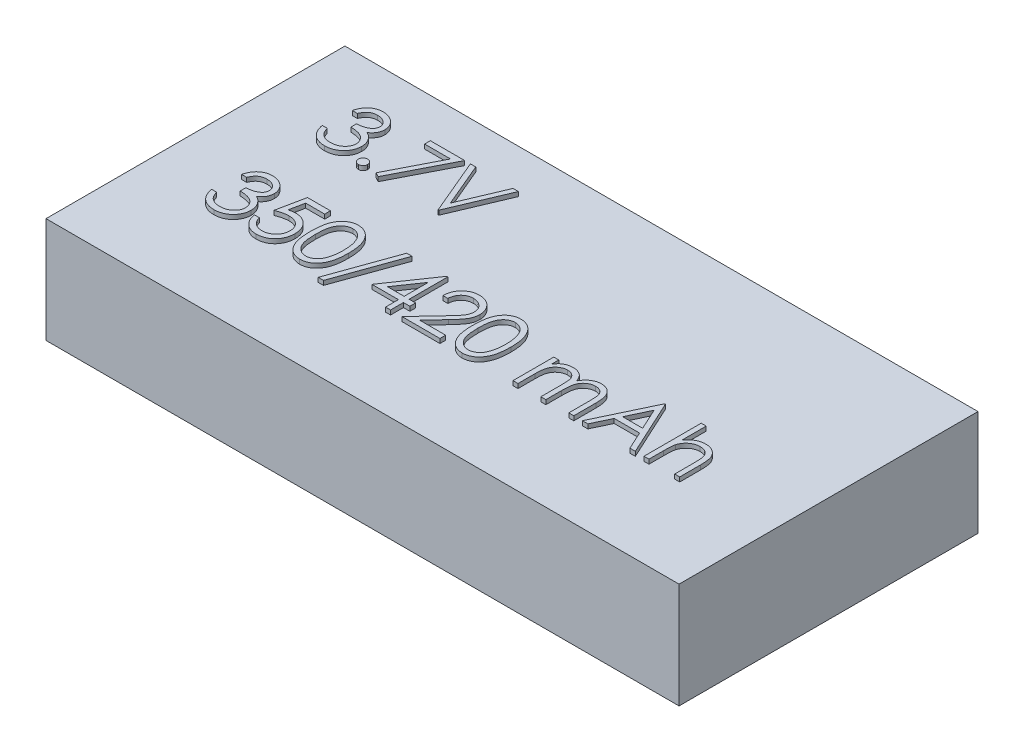
from build123d import *

# Parameters (mm, degrees)
SKETCH1_W           = 36
SKETCH1_H           = 17
BOSS_EXTRUDE1_DEPTH = 6
BOSS_EXTRUDE2_DEPTH = 0.25


with BuildPart() as part:
    # Sketch1 → Boss-Extrude1 (new body)
    with BuildSketch(Plane(origin=(0, 0, 0), x_dir=(1, 0, 0), z_dir=(0, 1, 0))):
        Rectangle(SKETCH1_W, SKETCH1_H)
    extrude(amount=BOSS_EXTRUDE1_DEPTH)

    # Sketch2 → Boss-Extrude2 (add)
    # profile 1 of 14: a face of its own
    with BuildSketch(Plane(origin=(0, 6, 0), x_dir=(1, 0, 0), z_dir=(0, 1, 0))):
        with BuildLine():
            Line((-14.07975886, 5.282911581), (-14.364694757, 5.282911581))
            add(Edge.make_bspline(
                [(-14.364694757, 5.282911581), (-14.356975379, 5.314872477), (-14.341884626, 5.377353415), (-14.31040897, 5.466622859), (-14.276119646, 5.551099196), (-14.234945244, 5.629200634), (-14.190033731, 5.702496782), (-14.13857812, 5.769325202), (-14.082952371, 5.831385535), (-14.021425453, 5.886461115), (-13.956901596, 5.936333769), (-13.888471619, 5.978856143), (-13.81751228, 6.01543591), (-13.743531938, 6.045571406), (-13.666310339, 6.068273131), (-13.58654561, 6.084743947), (-13.50402872, 6.095440172), (-13.448014834, 6.096484079), (-13.419572562, 6.097014145)],
                knots=[0, 0, 0, 0, 1.162005537, 2.271625781, 3.343758855, 4.383309926, 5.390229558, 6.379919256, 7.361854164, 8.333198761, 9.295911338, 10.242430842, 11.177959212, 12.116337295, 13.062827104, 14.020064771, 14.994644689, 16, 16, 16, 16], degree=3))
            add(Edge.make_bspline(
                [(-13.419572562, 6.097014145), (-13.378131789, 6.095762986), (-13.296154186, 6.09328796), (-13.175719136, 6.070687007), (-13.059580522, 6.03492278), (-12.949009561, 5.985507327), (-12.846304269, 5.924558836), (-12.754922156, 5.852019396), (-12.676101864, 5.769288601), (-12.60997625, 5.677909775), (-12.558201073, 5.580250849), (-12.52002272, 5.479739278), (-12.496780195, 5.376613489), (-12.493767975, 5.306983672), (-12.49225886, 5.272099281)],
                knots=[0, 0, 0, 0, 1.083050992, 2.142477498, 3.193116406, 4.255571735, 5.30263384, 6.308962982, 7.297363603, 8.282367274, 9.249857812, 10.179914175, 11.08814088, 12, 12, 12, 12], degree=3))
            add(Edge.make_bspline(
                [(-12.49225886, 5.272099281), (-12.493314403, 5.238528832), (-12.495379938, 5.172836672), (-12.51291837, 5.076932171), (-12.542433409, 4.986543005), (-12.583318122, 4.901288665), (-12.636242243, 4.821709703), (-12.700352475, 4.747627074), (-12.776101318, 4.678712194), (-12.833504355, 4.639233815), (-12.863057137, 4.618909177)],
                knots=[0, 0, 0, 0, 1.024540389, 2.004866551, 2.965041327, 3.920577974, 4.882998113, 5.874504559, 6.905732034, 8, 8, 8, 8], degree=3))
            add(Edge.make_bspline(
                [(-12.863057137, 4.618909177), (-12.829282617, 4.602600407), (-12.762365524, 4.570288017), (-12.671151829, 4.506918866), (-12.588349756, 4.433752036), (-12.542172811, 4.376654058), (-12.5189716, 4.347965668)],
                knots=[0, 0, 0, 0, 1.015518401, 2.012035669, 3.001164323, 4, 4, 4, 4], degree=3))
            add(Edge.make_bspline(
                [(-12.5189716, 4.347965668), (-12.503694097, 4.327048993), (-12.47338927, 4.285558169), (-12.43598275, 4.218850125), (-12.402047339, 4.151402703), (-12.375603926, 4.081408099), (-12.355126204, 4.009677579), (-12.340488517, 3.936087977), (-12.331395189, 3.8605792), (-12.330092939, 3.809495735), (-12.329438347, 3.783818031)],
                knots=[0, 0, 0, 0, 1.025084078, 2.033381695, 3.024893161, 4.013698104, 4.991890475, 5.976764909, 6.982997093, 8, 8, 8, 8], degree=3))
            add(Edge.make_bspline(
                [(-12.329438347, 3.783818031), (-12.331066227, 3.739359213), (-12.334314327, 3.6506508), (-12.363346594, 3.519591588), (-12.408352891, 3.391479882), (-12.472267397, 3.268947707), (-12.550161494, 3.154302647), (-12.642832781, 3.051726281), (-12.749228309, 2.963553261), (-12.867887719, 2.889883983), (-12.9964454, 2.830994154), (-13.133946115, 2.790120616), (-13.278408664, 2.763499602), (-13.377475284, 2.760644942), (-13.427840791, 2.759193632)],
                knots=[0, 0, 0, 0, 0.955779014, 1.907060117, 2.875433937, 3.871313158, 4.872415639, 5.851225146, 6.836215519, 7.83643374, 8.849228613, 9.86973379, 10.916971861, 12, 12, 12, 12], degree=3))
            add(Edge.make_bspline(
                [(-13.427840791, 2.759193632), (-13.461785442, 2.759981226), (-13.528577196, 2.761530947), (-13.626769512, 2.772125107), (-13.720497054, 2.791474469), (-13.809886546, 2.817512467), (-13.895017401, 2.850524976), (-13.975629839, 2.891635509), (-14.052219814, 2.939996658), (-14.124064576, 2.996179269), (-14.191155563, 3.059027342), (-14.25170982, 3.129656587), (-14.306736918, 3.206761374), (-14.354763454, 3.29123729), (-14.397976976, 3.38199263), (-14.433519701, 3.480189482), (-14.464803038, 3.584949988), (-14.47934768, 3.657954795), (-14.486810142, 3.695411581)],
                knots=[0, 0, 0, 0, 1.048658725, 2.063410685, 3.046034179, 4.001477787, 4.936774919, 5.862367409, 6.792675028, 7.730719943, 8.675894397, 9.627829632, 10.600096036, 11.597688215, 12.626045268, 13.701542398, 14.82072376, 16, 16, 16, 16], degree=3))
            Line((-14.486810142, 3.695411581), (-14.201874244, 3.695411581))
            add(Edge.make_bspline(
                [(-14.201874244, 3.695411581), (-14.19445083, 3.670964976), (-14.180011644, 3.623414206), (-14.155433245, 3.554979072), (-14.127431313, 3.492242838), (-14.097391678, 3.434745291), (-14.065842659, 3.381920184), (-14.030541262, 3.335164345), (-13.994102109, 3.292424126), (-13.96663441, 3.268344371), (-13.953191352, 3.256559418)],
                knots=[0, 0, 0, 0, 1.198163088, 2.33053128, 3.407730985, 4.417276592, 5.372219308, 6.28897303, 7.162600585, 8, 8, 8, 8], degree=3))
            add(Edge.make_bspline(
                [(-13.953191352, 3.256559418), (-13.935414457, 3.242854001), (-13.899915542, 3.215485472), (-13.842068646, 3.180558994), (-13.781231214, 3.150295779), (-13.716085045, 3.127178426), (-13.648035932, 3.107604405), (-13.575983965, 3.094795077), (-13.500564818, 3.086006522), (-13.449068347, 3.085230977), (-13.42275265, 3.084834658)],
                knots=[0, 0, 0, 0, 0.946170439, 1.889420265, 2.845303464, 3.807233317, 4.801018734, 5.828864929, 6.890507805, 8, 8, 8, 8], degree=3))
            add(Edge.make_bspline(
                [(-13.42275265, 3.084834658), (-13.393040544, 3.085393372), (-13.334941086, 3.086485889), (-13.250164178, 3.096533138), (-13.169512422, 3.111165727), (-13.093881267, 3.133765361), (-13.022280021, 3.161687991), (-12.955712382, 3.196747616), (-12.893304486, 3.237881756), (-12.835855668, 3.284635136), (-12.784197958, 3.335817492), (-12.738714256, 3.389350778), (-12.700047599, 3.44500928), (-12.668856782, 3.503101004), (-12.644227354, 3.563385391), (-12.627460451, 3.626031614), (-12.615802291, 3.690526992), (-12.614852864, 3.734368271), (-12.614374244, 3.756469273)],
                knots=[0, 0, 0, 0, 1.217147791, 2.380027433, 3.494444702, 4.572153297, 5.609568379, 6.639424714, 7.649109417, 8.668170816, 9.669597737, 10.625200337, 11.543417969, 12.441394052, 13.322311151, 14.205496177, 15.095365482, 16, 16, 16, 16], degree=3))
            add(Edge.make_bspline(
                [(-12.614374244, 3.756469273), (-12.615762447, 3.786052417), (-12.618531943, 3.845071501), (-12.639676155, 3.931901015), (-12.674454981, 4.015560825), (-12.723143617, 4.094623577), (-12.782412456, 4.167898859), (-12.851686336, 4.23327799), (-12.931540515, 4.287225858), (-13.00503711, 4.324499139), (-13.070138359, 4.349932772), (-13.125850887, 4.366873633), (-13.188222948, 4.381218877), (-13.256500279, 4.394565009), (-13.33119734, 4.405923661), (-13.412232808, 4.415395879), (-13.499623106, 4.422975095), (-13.560121521, 4.426359732), (-13.591297321, 4.428103889)],
                knots=[0, 0, 0, 0, 1.07054697, 2.135767047, 3.216561865, 4.33974944, 5.486079747, 6.621378074, 7.775625952, 8.963672916, 9.598146892, 10.304877434, 11.070270905, 11.915000392, 12.823868403, 13.805723172, 14.86925407, 16, 16, 16, 16], degree=3))
            Line((-13.591297321, 4.428103889), (-13.591297321, 4.753744914))
            add(Edge.make_bspline(
                [(-13.591297321, 4.753744914), (-13.552016978, 4.754411486), (-13.475076435, 4.755717137), (-13.362686602, 4.771508689), (-13.255214383, 4.793353259), (-13.155041553, 4.826813398), (-13.063738791, 4.865675667), (-12.984527438, 4.910898743), (-12.91851724, 4.961167837), (-12.866028982, 5.017258847), (-12.826541753, 5.077416068), (-12.797670301, 5.140114751), (-12.78061572, 5.205904435), (-12.778339093, 5.250803169), (-12.777194757, 5.273371317)],
                knots=[0, 0, 0, 0, 1.321986639, 2.589447074, 3.816329219, 5.01088745, 6.139805852, 7.153945165, 8.075214402, 8.924034688, 9.728124013, 10.488707548, 11.240355623, 12, 12, 12, 12], degree=3))
            add(Edge.make_bspline(
                [(-12.777194757, 5.273371317), (-12.777570687, 5.289951843), (-12.778318582, 5.322938013), (-12.787750398, 5.371130039), (-12.801923635, 5.417848755), (-12.821408818, 5.462895482), (-12.847489356, 5.505957802), (-12.878700501, 5.547402845), (-12.91586442, 5.586993988), (-12.958450647, 5.623896849), (-13.004181356, 5.659066086), (-13.054300795, 5.688923456), (-13.107297781, 5.714455048), (-13.16323099, 5.735509382), (-13.222281935, 5.751347451), (-13.284173169, 5.76271925), (-13.349022711, 5.769829122), (-13.393265639, 5.770852757), (-13.415756456, 5.77137312)],
                knots=[0, 0, 0, 0, 0.884392785, 1.759457502, 2.611959086, 3.489218968, 4.37281399, 5.2945488, 6.255912374, 7.266815255, 8.301784654, 9.332968512, 10.37626691, 11.440494194, 12.520033166, 13.637162961, 14.798855837, 16, 16, 16, 16], degree=3))
            add(Edge.make_bspline(
                [(-13.415756456, 5.77137312), (-13.451907612, 5.770110956), (-13.522519228, 5.767645655), (-13.624314188, 5.746052922), (-13.718946727, 5.711601375), (-13.791281089, 5.67047785), (-13.844695995, 5.629882813), (-13.882865789, 5.594429506), (-13.920349395, 5.55502973), (-13.95468083, 5.509256775), (-13.989400795, 5.460210473), (-14.02100979, 5.405397562), (-14.051725368, 5.346247861), (-14.070233395, 5.304432536), (-14.07975886, 5.282911581)],
                knots=[0, 0, 0, 0, 1.472543308, 2.876219568, 4.221790263, 5.565193594, 6.249813518, 6.953379497, 7.687249741, 8.463570142, 9.283606569, 10.136032583, 11.040678096, 12, 12, 12, 12], degree=3))
        make_face()
    # profile 2 of 14: a face of its own
    with BuildSketch(Plane(origin=(0, 6, 0), x_dir=(1, 0, 0), z_dir=(0, 1, 0))):
        with BuildLine():
            add(Edge.make_bspline(
                [(-11.535688347, 3.329065427), (-11.51800794, 3.328014805), (-11.48334757, 3.325955182), (-11.433237789, 3.311824913), (-11.387885491, 3.286734557), (-11.347488383, 3.253294751), (-11.314190365, 3.2127494), (-11.288205845, 3.167758825), (-11.274198666, 3.117229523), (-11.272154046, 3.082368318), (-11.271105014, 3.064482094)],
                knots=[0, 0, 0, 0, 1.020151414, 1.999887582, 2.974338812, 3.990962822, 5.007586832, 5.987933904, 6.967670073, 8, 8, 8, 8], degree=3))
            add(Edge.make_bspline(
                [(-11.271105014, 3.064482094), (-11.272189594, 3.047025645), (-11.274328372, 3.012601783), (-11.288173737, 2.9624536), (-11.314388397, 2.917434908), (-11.347258712, 2.876339397), (-11.387895477, 2.84282875), (-11.433345009, 2.817951858), (-11.483229936, 2.802809848), (-11.517988315, 2.800880993), (-11.535688347, 2.799898761)],
                knots=[0, 0, 0, 0, 1.009421747, 1.99056486, 2.972319754, 3.999869655, 5.017953583, 5.993804169, 6.978383603, 8, 8, 8, 8], degree=3))
            add(Edge.make_bspline(
                [(-11.535688347, 2.799898761), (-11.553401133, 2.800845452), (-11.587981131, 2.802693643), (-11.637679854, 2.81826276), (-11.683406175, 2.84259547), (-11.724035028, 2.876401881), (-11.757180642, 2.917223439), (-11.782240811, 2.962763641), (-11.797290446, 3.01245823), (-11.799269716, 3.04699737), (-11.80027168, 3.064482094)],
                knots=[0, 0, 0, 0, 1.022052826, 1.995314843, 2.982371812, 4.00089066, 5.028879526, 6.005146991, 6.990147033, 8, 8, 8, 8], degree=3))
            add(Edge.make_bspline(
                [(-11.80027168, 3.064482094), (-11.799308205, 3.082397603), (-11.797427136, 3.117375435), (-11.782209216, 3.167448911), (-11.757375081, 3.212958852), (-11.723805901, 3.253232893), (-11.683416004, 3.286967089), (-11.637790161, 3.311518722), (-11.587861435, 3.326069668), (-11.553380991, 3.328049522), (-11.535688347, 3.329065427)],
                knots=[0, 0, 0, 0, 1.032775665, 2.016367738, 2.991239715, 4.008302682, 5.025365648, 6.011011707, 6.979408107, 8, 8, 8, 8], degree=3))
        make_face()
    # profile 3 of 14: a face of its own
    with BuildSketch(Plane(origin=(0, 6, 0), x_dir=(1, 0, 0), z_dir=(0, 1, 0))):
        Polygon((-10.660528091, 6.015603889), (-8.706681937, 6.015603889), (-10.375592193, 2.759193632), (-10.621731015, 2.894665387), (-9.188783299, 5.689962863), (-10.660528091, 5.689962863), align=None)
    # profile 4 of 14: a face of its own
    with BuildSketch(Plane(origin=(0, 6, 0), x_dir=(1, 0, 0), z_dir=(0, 1, 0))):
        Polygon((-8.381040911, 6.015603889), (-8.07575245, 6.015603889), (-7.017419116, 3.513510539), (-5.959085783, 6.015603889), (-5.653797321, 6.015603889), (-6.997066552, 2.840603889), (-7.03777168, 2.840603889), align=None)
    # profile 5 of 14: a face of its own
    with BuildSketch(Plane(origin=(0, 6, 0), x_dir=(1, 0, 0), z_dir=(0, 1, 0))):
        with BuildLine():
            Line((-14.07975886, -1.008755086), (-14.364694757, -1.008755086))
            add(Edge.make_bspline(
                [(-14.364694757, -1.008755086), (-14.356975379, -0.976794189), (-14.341884626, -0.914313251), (-14.31040897, -0.825043808), (-14.276119646, -0.74056747), (-14.234945244, -0.662466032), (-14.190033731, -0.589169885), (-14.13857812, -0.522341465), (-14.082952371, -0.460281132), (-14.021425453, -0.405205552), (-13.956901596, -0.355332898), (-13.888471619, -0.312810524), (-13.81751228, -0.276230757), (-13.743531938, -0.246095261), (-13.666310339, -0.223393536), (-13.58654561, -0.206922719), (-13.50402872, -0.196226494), (-13.448014834, -0.195182588), (-13.419572562, -0.194652521)],
                knots=[0, 0, 0, 0, 1.162005537, 2.271625781, 3.343758855, 4.383309926, 5.390229558, 6.379919256, 7.361854164, 8.333198761, 9.295911338, 10.242430842, 11.177959212, 12.116337295, 13.062827104, 14.020064771, 14.994644689, 16, 16, 16, 16], degree=3))
            add(Edge.make_bspline(
                [(-13.419572562, -0.194652521), (-13.378131789, -0.19590368), (-13.296154186, -0.198378707), (-13.175719136, -0.22097966), (-13.059580522, -0.256743887), (-12.949009561, -0.306159339), (-12.846304269, -0.367107831), (-12.754922156, -0.43964727), (-12.676101864, -0.522378065), (-12.60997625, -0.613756892), (-12.558201073, -0.711415818), (-12.52002272, -0.811927389), (-12.496780195, -0.915053177), (-12.493767975, -0.984682995), (-12.49225886, -1.019567385)],
                knots=[0, 0, 0, 0, 1.083050992, 2.142477498, 3.193116406, 4.255571735, 5.30263384, 6.308962982, 7.297363603, 8.282367274, 9.249857812, 10.179914175, 11.08814088, 12, 12, 12, 12], degree=3))
            add(Edge.make_bspline(
                [(-12.49225886, -1.019567385), (-12.493314403, -1.053137835), (-12.495379938, -1.118829995), (-12.51291837, -1.214734496), (-12.542433409, -1.305123662), (-12.583318122, -1.390378002), (-12.636242243, -1.469956964), (-12.700352475, -1.544039593), (-12.776101318, -1.612954472), (-12.833504355, -1.652432851), (-12.863057137, -1.672757489)],
                knots=[0, 0, 0, 0, 1.024540389, 2.004866551, 2.965041327, 3.920577974, 4.882998113, 5.874504559, 6.905732034, 8, 8, 8, 8], degree=3))
            add(Edge.make_bspline(
                [(-12.863057137, -1.672757489), (-12.829282617, -1.689066259), (-12.762365524, -1.721378649), (-12.671151829, -1.784747801), (-12.588349756, -1.85791463), (-12.542172811, -1.915012608), (-12.5189716, -1.943700999)],
                knots=[0, 0, 0, 0, 1.015518401, 2.012035669, 3.001164323, 4, 4, 4, 4], degree=3))
            add(Edge.make_bspline(
                [(-12.5189716, -1.943700999), (-12.503694097, -1.964617674), (-12.47338927, -2.006108498), (-12.43598275, -2.072816541), (-12.402047339, -2.140263964), (-12.375603926, -2.210258568), (-12.355126204, -2.281989087), (-12.340488517, -2.35557869), (-12.331395189, -2.431087467), (-12.330092939, -2.482170931), (-12.329438347, -2.507848635)],
                knots=[0, 0, 0, 0, 1.025084078, 2.033381695, 3.024893161, 4.013698104, 4.991890475, 5.976764909, 6.982997093, 8, 8, 8, 8], degree=3))
            add(Edge.make_bspline(
                [(-12.329438347, -2.507848635), (-12.331066227, -2.552307454), (-12.334314327, -2.641015867), (-12.363346594, -2.772075079), (-12.408352891, -2.900186784), (-12.472267397, -3.02271896), (-12.550161494, -3.13736402), (-12.642832781, -3.239940386), (-12.749228309, -3.328113405), (-12.867887719, -3.401782684), (-12.9964454, -3.460672513), (-13.133946115, -3.501546051), (-13.278408664, -3.528167065), (-13.377475284, -3.531021724), (-13.427840791, -3.532473034)],
                knots=[0, 0, 0, 0, 0.955779014, 1.907060117, 2.875433937, 3.871313158, 4.872415639, 5.851225146, 6.836215519, 7.83643374, 8.849228613, 9.86973379, 10.916971861, 12, 12, 12, 12], degree=3))
            add(Edge.make_bspline(
                [(-13.427840791, -3.532473034), (-13.461785442, -3.531685441), (-13.528577196, -3.530135719), (-13.626769512, -3.51954156), (-13.720497054, -3.500192198), (-13.809886546, -3.474154199), (-13.895017401, -3.441141691), (-13.975629839, -3.400031157), (-14.052219814, -3.351670009), (-14.124064576, -3.295487397), (-14.191155563, -3.232639325), (-14.25170982, -3.16201008), (-14.306736918, -3.084905292), (-14.354763454, -3.000429377), (-14.397976976, -2.909674036), (-14.433519701, -2.811477184), (-14.464803038, -2.706716679), (-14.47934768, -2.633711872), (-14.486810142, -2.596255086)],
                knots=[0, 0, 0, 0, 1.048658725, 2.063410685, 3.046034179, 4.001477787, 4.936774919, 5.862367409, 6.792675028, 7.730719943, 8.675894397, 9.627829632, 10.600096036, 11.597688215, 12.626045268, 13.701542398, 14.82072376, 16, 16, 16, 16], degree=3))
            Line((-14.486810142, -2.596255086), (-14.201874244, -2.596255086))
            add(Edge.make_bspline(
                [(-14.201874244, -2.596255086), (-14.19445083, -2.62070169), (-14.180011644, -2.66825246), (-14.155433245, -2.736687595), (-14.127431313, -2.799423829), (-14.097391678, -2.856921375), (-14.065842659, -2.909746483), (-14.030541262, -2.956502321), (-13.994102109, -2.999242541), (-13.96663441, -3.023322296), (-13.953191352, -3.035107249)],
                knots=[0, 0, 0, 0, 1.198163088, 2.33053128, 3.407730985, 4.417276592, 5.372219308, 6.28897303, 7.162600585, 8, 8, 8, 8], degree=3))
            add(Edge.make_bspline(
                [(-13.953191352, -3.035107249), (-13.935414457, -3.048812666), (-13.899915542, -3.076181195), (-13.842068646, -3.111107672), (-13.781231214, -3.141370888), (-13.716085045, -3.164488241), (-13.648035932, -3.184062262), (-13.575983965, -3.19687159), (-13.500564818, -3.205660145), (-13.449068347, -3.20643569), (-13.42275265, -3.206832009)],
                knots=[0, 0, 0, 0, 0.946170439, 1.889420265, 2.845303464, 3.807233317, 4.801018734, 5.828864929, 6.890507805, 8, 8, 8, 8], degree=3))
            add(Edge.make_bspline(
                [(-13.42275265, -3.206832009), (-13.393040544, -3.206273295), (-13.334941086, -3.205180777), (-13.250164178, -3.195133529), (-13.169512422, -3.18050094), (-13.093881267, -3.157901305), (-13.022280021, -3.129978676), (-12.955712382, -3.094919051), (-12.893304486, -3.053784911), (-12.835855668, -3.007031531), (-12.784197958, -2.955849175), (-12.738714256, -2.902315889), (-12.700047599, -2.846657386), (-12.668856782, -2.788565662), (-12.644227354, -2.728281276), (-12.627460451, -2.665635052), (-12.615802291, -2.601139675), (-12.614852864, -2.557298396), (-12.614374244, -2.535197393)],
                knots=[0, 0, 0, 0, 1.217147791, 2.380027433, 3.494444702, 4.572153297, 5.609568379, 6.639424714, 7.649109417, 8.668170816, 9.669597737, 10.625200337, 11.543417969, 12.441394052, 13.322311151, 14.205496177, 15.095365482, 16, 16, 16, 16], degree=3))
            add(Edge.make_bspline(
                [(-12.614374244, -2.535197393), (-12.615762447, -2.50561425), (-12.618531943, -2.446595165), (-12.639676155, -2.359765652), (-12.674454981, -2.276105842), (-12.723143617, -2.197043089), (-12.782412456, -2.123767807), (-12.851686336, -2.058388677), (-12.931540515, -2.004440808), (-13.00503711, -1.967167527), (-13.070138359, -1.941733895), (-13.125850887, -1.924793034), (-13.188222948, -1.910447789), (-13.256500279, -1.897101657), (-13.33119734, -1.885743006), (-13.412232808, -1.876270787), (-13.499623106, -1.868691572), (-13.560121521, -1.865306935), (-13.591297321, -1.863562778)],
                knots=[0, 0, 0, 0, 1.07054697, 2.135767047, 3.216561865, 4.33974944, 5.486079747, 6.621378074, 7.775625952, 8.963672916, 9.598146892, 10.304877434, 11.070270905, 11.915000392, 12.823868403, 13.805723172, 14.86925407, 16, 16, 16, 16], degree=3))
            Line((-13.591297321, -1.863562778), (-13.591297321, -1.537921752))
            add(Edge.make_bspline(
                [(-13.591297321, -1.537921752), (-13.552016978, -1.53725518), (-13.475076435, -1.53594953), (-13.362686602, -1.520157977), (-13.255214383, -1.498313408), (-13.155041553, -1.464853269), (-13.063738791, -1.425991), (-12.984527438, -1.380767924), (-12.91851724, -1.33049883), (-12.866028982, -1.27440782), (-12.826541753, -1.214250598), (-12.797670301, -1.151551916), (-12.78061572, -1.085762232), (-12.778339093, -1.040863498), (-12.777194757, -1.01829535)],
                knots=[0, 0, 0, 0, 1.321986639, 2.589447074, 3.816329219, 5.01088745, 6.139805852, 7.153945165, 8.075214402, 8.924034688, 9.728124013, 10.488707548, 11.240355623, 12, 12, 12, 12], degree=3))
            add(Edge.make_bspline(
                [(-12.777194757, -1.01829535), (-12.777570687, -1.001714824), (-12.778318582, -0.968728654), (-12.787750398, -0.920536627), (-12.801923635, -0.873817912), (-12.821408818, -0.828771184), (-12.847489356, -0.785708864), (-12.878700501, -0.744263821), (-12.91586442, -0.704672679), (-12.958450647, -0.667769818), (-13.004181356, -0.632600581), (-13.054300795, -0.60274321), (-13.107297781, -0.577211618), (-13.16323099, -0.556157284), (-13.222281935, -0.540319216), (-13.284173169, -0.528947417), (-13.349022711, -0.521837544), (-13.393265639, -0.52081391), (-13.415756456, -0.520293547)],
                knots=[0, 0, 0, 0, 0.884392785, 1.759457502, 2.611959086, 3.489218968, 4.37281399, 5.2945488, 6.255912374, 7.266815255, 8.301784654, 9.332968512, 10.37626691, 11.440494194, 12.520033166, 13.637162961, 14.798855837, 16, 16, 16, 16], degree=3))
            add(Edge.make_bspline(
                [(-13.415756456, -0.520293547), (-13.451907612, -0.521555711), (-13.522519228, -0.524021011), (-13.624314188, -0.545613745), (-13.718946727, -0.580065292), (-13.791281089, -0.621188817), (-13.844695995, -0.661783853), (-13.882865789, -0.697237161), (-13.920349395, -0.736636937), (-13.95468083, -0.782409891), (-13.989400795, -0.831456194), (-14.02100979, -0.886269105), (-14.051725368, -0.945418805), (-14.070233395, -0.987234131), (-14.07975886, -1.008755086)],
                knots=[0, 0, 0, 0, 1.472543308, 2.876219568, 4.221790263, 5.565193594, 6.249813518, 6.953379497, 7.687249741, 8.463570142, 9.283606569, 10.136032583, 11.040678096, 12, 12, 12, 12], degree=3))
        make_face()
    # profile 6 of 14: a face of its own
    with BuildSketch(Plane(origin=(0, 6, 0), x_dir=(1, 0, 0), z_dir=(0, 1, 0))):
        with BuildLine():
            Line((-10.049951168, -0.276062778), (-10.049951168, -0.601703803))
            Line((-10.049951168, -0.601703803), (-11.1299091, -0.601703803))
            Line((-11.1299091, -0.601703803), (-11.300997842, -1.436794949))
            add(Edge.make_bspline(
                [(-11.300997842, -1.436794949), (-11.26738287, -1.427514631), (-11.202259179, -1.409535483), (-11.106138448, -1.389573105), (-11.014886949, -1.377539453), (-10.955672863, -1.375896335), (-10.927019477, -1.375101239)],
                knots=[0, 0, 0, 0, 1.100273476, 2.13160584, 3.095893838, 4, 4, 4, 4], degree=3))
            add(Edge.make_bspline(
                [(-10.927019477, -1.375101239), (-10.891564941, -1.375868624), (-10.821852467, -1.377377494), (-10.719854279, -1.391866243), (-10.622488012, -1.414671737), (-10.52995729, -1.446531067), (-10.442090934, -1.487270611), (-10.35969736, -1.538161271), (-10.281539825, -1.597609364), (-10.209020471, -1.665958054), (-10.143230563, -1.741179806), (-10.085385701, -1.822058732), (-10.036252494, -1.907808825), (-9.996736667, -1.999249378), (-9.965182306, -2.095369467), (-9.94418014, -2.197180452), (-9.930194982, -2.303722676), (-9.928632532, -2.376570393), (-9.927835783, -2.413718026)],
                knots=[0, 0, 0, 0, 1.052922333, 2.070308379, 3.05430497, 4.020497103, 4.973039431, 5.925935799, 6.892292201, 7.88610001, 8.88166317, 9.857072816, 10.836096531, 11.812156883, 12.81219415, 13.836441305, 14.89672472, 16, 16, 16, 16], degree=3))
            add(Edge.make_bspline(
                [(-9.927835783, -2.413718026), (-9.928439101, -2.439591755), (-9.929637584, -2.490989551), (-9.935732303, -2.567320361), (-9.947466846, -2.642035217), (-9.963221853, -2.715144029), (-9.983671046, -2.786508389), (-10.008426116, -2.85633256), (-10.038721084, -2.924181954), (-10.071950975, -2.990698562), (-10.109367422, -3.054378636), (-10.150895068, -3.113931646), (-10.194769478, -3.170250958), (-10.241978449, -3.222732559), (-10.292960781, -3.271031582), (-10.347099036, -3.315434666), (-10.403961217, -3.35669273), (-10.464427044, -3.393131021), (-10.527149154, -3.426661703), (-10.593033322, -3.454169483), (-10.660579815, -3.478762605), (-10.730760809, -3.498365534), (-10.803417339, -3.51372578), (-10.878669171, -3.524158467), (-10.956121636, -3.531757093), (-11.00862254, -3.532232759), (-11.035142474, -3.532473034)],
                knots=[0, 0, 0, 0, 1.056347294, 2.098418968, 3.122841568, 4.141288669, 5.149314143, 6.15115421, 7.162517403, 8.180376062, 9.185164535, 10.17417709, 11.141909838, 12.097768115, 13.052685741, 14.0056014, 14.954263652, 15.917497458, 16.885230207, 17.854509472, 18.828990115, 19.81800267, 20.826176721, 21.857883937, 22.917946725, 24, 24, 24, 24], degree=3))
            add(Edge.make_bspline(
                [(-11.035142474, -3.532473034), (-11.066778338, -3.531846345), (-11.129018163, -3.530613409), (-11.220204677, -3.517715212), (-11.307938641, -3.499242231), (-11.391513804, -3.471450757), (-11.471679165, -3.436627997), (-11.547355487, -3.392616899), (-11.620476441, -3.342742998), (-11.688069503, -3.283887249), (-11.750803977, -3.219556594), (-11.806962025, -3.14974502), (-11.856976055, -3.07560474), (-11.900045154, -2.996775701), (-11.936782645, -2.913465033), (-11.965643384, -2.825360597), (-11.98893732, -2.732922736), (-11.998791995, -2.66928348), (-12.003797321, -2.636960214)],
                knots=[0, 0, 0, 0, 1.0467383, 2.05933395, 3.04377827, 4.011590433, 4.970194871, 5.932262533, 6.905835911, 7.896367577, 8.894135286, 9.877477877, 10.858688626, 11.851381753, 12.8477658, 13.868841284, 14.917554742, 16, 16, 16, 16], degree=3))
            Line((-12.003797321, -2.636960214), (-11.718861424, -2.636960214))
            add(Edge.make_bspline(
                [(-11.718861424, -2.636960214), (-11.711850518, -2.667237424), (-11.698375168, -2.725431904), (-11.668797096, -2.807193906), (-11.632633052, -2.880054916), (-11.589630536, -2.944978753), (-11.53833158, -3.001592629), (-11.479794169, -3.052045249), (-11.414164449, -3.097561259), (-11.341236305, -3.135500484), (-11.264298726, -3.167857139), (-11.183774185, -3.189403319), (-11.101855243, -3.204553415), (-11.046448435, -3.206069941), (-11.018606015, -3.206832009)],
                knots=[0, 0, 0, 0, 1.136247022, 2.183929868, 3.172523383, 4.106158343, 5.02341133, 5.958108904, 6.928429099, 7.938127109, 8.96079061, 9.975095812, 10.982467395, 12, 12, 12, 12], degree=3))
            add(Edge.make_bspline(
                [(-11.018606015, -3.206832009), (-10.991429426, -3.206087446), (-10.937918501, -3.204621396), (-10.859168171, -3.193337435), (-10.783137921, -3.175958781), (-10.710577962, -3.149951126), (-10.640218565, -3.118341989), (-10.573839502, -3.077779027), (-10.509520463, -3.031097439), (-10.449260657, -2.977615353), (-10.394070585, -2.918678559), (-10.345306103, -2.855652638), (-10.304687046, -2.78841807), (-10.270456819, -2.718138853), (-10.244464183, -2.644044733), (-10.225921293, -2.566482953), (-10.215032804, -2.485261935), (-10.213534948, -2.429863347), (-10.21277168, -2.401633691)],
                knots=[0, 0, 0, 0, 1.027316725, 2.022795036, 3.002884548, 3.971462791, 4.93288096, 5.914575861, 6.907176829, 7.935150275, 8.956128384, 9.956726525, 10.942570165, 11.921478529, 12.907843606, 13.90538589, 14.932640048, 16, 16, 16, 16], degree=3))
            add(Edge.make_bspline(
                [(-10.21277168, -2.401633691), (-10.213369015, -2.376164974), (-10.214538213, -2.326313583), (-10.224090945, -2.253380017), (-10.240707056, -2.1843709), (-10.263770147, -2.118952988), (-10.293052272, -2.05706458), (-10.328835712, -1.998641803), (-10.371792009, -1.944454683), (-10.420861079, -1.894477867), (-10.474616588, -1.848354302), (-10.533983411, -1.809035023), (-10.597719202, -1.775957041), (-10.665056053, -1.747411071), (-10.73759564, -1.726908966), (-10.813901442, -1.71151667), (-10.894797456, -1.702612734), (-10.95010658, -1.701377307), (-10.978536905, -1.700742265)],
                knots=[0, 0, 0, 0, 1.045622112, 2.046656509, 3.013763289, 3.955457236, 4.890082067, 5.820317437, 6.762574623, 7.722996705, 8.69280354, 9.665887285, 10.63943826, 11.638615906, 12.663482002, 13.728887084, 14.832589034, 16, 16, 16, 16], degree=3))
            add(Edge.make_bspline(
                [(-10.978536905, -1.700742265), (-11.003146719, -1.701268944), (-11.053959741, -1.702356403), (-11.13190402, -1.710363296), (-11.213811511, -1.723280371), (-11.299368232, -1.741047895), (-11.388831122, -1.764298943), (-11.482011385, -1.792161383), (-11.579104941, -1.825473482), (-11.64452602, -1.850630562), (-11.678156296, -1.863562778)],
                knots=[0, 0, 0, 0, 0.817624296, 1.688186739, 2.600797293, 3.572016777, 4.590301741, 5.671205678, 6.80286297, 8, 8, 8, 8], degree=3))
            Line((-11.678156296, -1.863562778), (-11.35251527, -0.276062778))
            Line((-11.35251527, -0.276062778), (-10.049951168, -0.276062778))
        make_face()
    # profile 7 of 14: a face of its own
    with BuildSketch(Plane(origin=(0, 6, 0), x_dir=(1, 0, 0), z_dir=(0, 1, 0))):
        with BuildLine():
            add(Edge.make_bspline(
                [(-9.602194757, -1.864834813), (-9.601897198, -1.813946468), (-9.601319185, -1.715095126), (-9.594888974, -1.571054772), (-9.584207057, -1.43592651), (-9.569568154, -1.309703871), (-9.551753701, -1.19235427), (-9.527972509, -1.084191312), (-9.500928038, -0.984714383), (-9.469584034, -0.893599097), (-9.434216539, -0.809617894), (-9.395722603, -0.73121789), (-9.352574539, -0.658517709), (-9.30723834, -0.590356999), (-9.257878818, -0.527851505), (-9.205900629, -0.470118518), (-9.14927507, -0.418492337), (-9.089927055, -0.371460334), (-9.027319263, -0.330231171), (-8.963236273, -0.293915758), (-8.897236998, -0.262891592), (-8.829141246, -0.238498126), (-8.759561069, -0.218349715), (-8.68825323, -0.204571169), (-8.615099993, -0.195901688), (-8.565722905, -0.195072861), (-8.540681336, -0.194652521)],
                knots=[0, 0, 0, 0, 1.646270934, 3.197905019, 4.663502075, 6.030701355, 7.308322542, 8.50163776, 9.611534131, 10.641858119, 11.616356847, 12.558055219, 13.465016945, 14.349605745, 15.204443733, 16.039544428, 16.859896111, 17.680448484, 18.487036065, 19.28249412, 20.06191084, 20.843045899, 21.620316918, 22.403196591, 23.190181807, 24, 24, 24, 24], degree=3))
            add(Edge.make_bspline(
                [(-8.540681336, -0.194652521), (-8.51543058, -0.195095039), (-8.465214772, -0.195975069), (-8.39097386, -0.204433217), (-8.318448078, -0.218467735), (-8.247946623, -0.238353191), (-8.178890386, -0.263023555), (-8.111819502, -0.293945439), (-8.046317363, -0.329939841), (-7.983424888, -0.372234358), (-7.92245163, -0.419389708), (-7.864895263, -0.472695844), (-7.81075055, -0.531614518), (-7.759337951, -0.595515351), (-7.712116088, -0.665623964), (-7.667145903, -0.740720978), (-7.626894128, -0.822119691), (-7.588127672, -0.908461972), (-7.554665906, -1.002136863), (-7.524488669, -1.102616324), (-7.500105605, -1.211087194), (-7.479795336, -1.326980359), (-7.464061038, -1.450721433), (-7.452601427, -1.582045162), (-7.446547985, -1.721037945), (-7.445407978, -1.81606828), (-7.444822962, -1.864834813)],
                knots=[0, 0, 0, 0, 0.810914788, 1.612654377, 2.396697861, 3.181598691, 3.963628158, 4.749916497, 5.551656086, 6.361998678, 7.18212741, 8.025565596, 8.878627764, 9.750805457, 10.657531673, 11.591944965, 12.560506719, 13.57287815, 14.630710178, 15.753379473, 16.941251878, 18.199788006, 19.531962791, 20.947069417, 22.433333509, 24, 24, 24, 24], degree=3))
            add(Edge.make_bspline(
                [(-7.444822962, -1.864834813), (-7.445414043, -1.913388644), (-7.446565738, -2.007993803), (-7.452533565, -2.146361188), (-7.464288895, -2.276987984), (-7.47899367, -2.400187475), (-7.499359901, -2.515446887), (-7.52440173, -2.623165065), (-7.552205952, -2.723807187), (-7.586527515, -2.816548766), (-7.624092945, -2.902683543), (-7.664964444, -2.983117313), (-7.708752072, -3.058561022), (-7.756457577, -3.128410792), (-7.80730603, -3.193161431), (-7.862385738, -3.251669989), (-7.920144055, -3.305346241), (-7.981296746, -3.353108789), (-8.045170082, -3.39491429), (-8.110447245, -3.43230114), (-8.178286457, -3.462447942), (-8.24715035, -3.488333301), (-8.318023939, -3.508109425), (-8.390818879, -3.521783566), (-8.465164893, -3.531373742), (-8.515422027, -3.532105335), (-8.540681336, -3.532473034)],
                knots=[0, 0, 0, 0, 1.561518951, 3.042555995, 4.452378317, 5.7783523, 7.031515105, 8.214008947, 9.334062868, 10.386615937, 11.391082383, 12.354592575, 13.286541444, 14.194233754, 15.072674879, 15.931287219, 16.775624067, 17.606195743, 18.42308326, 19.229000347, 20.022332153, 20.807536673, 21.593273796, 22.3848459, 23.188221202, 24, 24, 24, 24], degree=3))
            add(Edge.make_bspline(
                [(-8.540681336, -3.532473034), (-8.565722211, -3.532049983), (-8.615097928, -3.531215809), (-8.6882612, -3.522585496), (-8.759274559, -3.508710289), (-8.828488429, -3.48928237), (-8.89625791, -3.465501768), (-8.961659542, -3.434519498), (-9.025420512, -3.398837878), (-9.087370709, -3.358202032), (-9.146346027, -3.311645934), (-9.202678333, -3.260152614), (-9.254952458, -3.202437091), (-9.303606244, -3.13941069), (-9.349847024, -3.071653248), (-9.392382384, -2.998239653), (-9.431725945, -2.919460999), (-9.467688254, -2.834808323), (-9.499573113, -2.743046353), (-9.52773782, -2.643125312), (-9.549975663, -2.534163271), (-9.569010201, -2.417035374), (-9.584363034, -2.291238308), (-9.594844458, -2.156703781), (-9.601322651, -2.013515627), (-9.60189875, -1.915299475), (-9.602194757, -1.864834813)],
                knots=[0, 0, 0, 0, 0.810891512, 1.598919785, 2.382837074, 3.152667961, 3.926044502, 4.706494248, 5.493654104, 6.291793342, 7.103789334, 7.925228297, 8.761435821, 9.622817696, 10.50288917, 11.416980706, 12.369136599, 13.353924996, 14.394355917, 15.514179734, 16.714354668, 17.994756427, 19.357759367, 20.818452758, 22.365282078, 24, 24, 24, 24], degree=3))
        make_face()
        with BuildLine():
            add(Edge.make_bspline(
                [(-9.31725886, -1.863562778), (-9.317150504, -1.905970526), (-9.316940207, -1.988275638), (-9.311446368, -2.107876311), (-9.303962229, -2.219427966), (-9.294309053, -2.323072245), (-9.279973521, -2.418458328), (-9.263910935, -2.506242255), (-9.244363739, -2.585959463), (-9.221236116, -2.658156977), (-9.194893506, -2.724060061), (-9.166131759, -2.78538402), (-9.135233817, -2.842853277), (-9.100654302, -2.895951621), (-9.062994209, -2.944852213), (-9.023104181, -2.990420568), (-8.97949548, -3.03105783), (-8.919167084, -3.079795763), (-8.83952314, -3.130159548), (-8.739174584, -3.174016358), (-8.636061061, -3.201577586), (-8.566073855, -3.205082565), (-8.531141071, -3.206832009)],
                knots=[0, 0, 0, 0, 1.459021318, 2.831673884, 4.118529203, 5.306027144, 6.411944654, 7.436330062, 8.375795394, 9.233974572, 10.042671642, 10.816086306, 11.563610507, 12.285937304, 12.993564865, 13.685989202, 14.367179055, 15.041617293, 16.353048772, 17.594441528, 18.799311195, 20, 20, 20, 20], degree=3))
            add(Edge.make_bspline(
                [(-8.531141071, -3.206832009), (-8.495982326, -3.205382593), (-8.425737426, -3.202486755), (-8.323108912, -3.1745479), (-8.223477167, -3.132393389), (-8.145397621, -3.082548152), (-8.085995599, -3.035078882), (-8.043435187, -2.994607022), (-8.004371757, -2.949289914), (-7.967322161, -2.900395553), (-7.933341428, -2.846989799), (-7.902441296, -2.789329463), (-7.874244259, -2.727254423), (-7.858179625, -2.683920446), (-7.849966192, -2.661764901)],
                knots=[0, 0, 0, 0, 1.353760809, 2.704726607, 4.075137775, 5.516104923, 6.260822281, 7.007110065, 7.778089737, 8.566572457, 9.372053459, 10.217411131, 11.088608312, 12, 12, 12, 12], degree=3))
            add(Edge.make_bspline(
                [(-7.849966192, -2.661764901), (-7.840394231, -2.633435066), (-7.820959045, -2.575913351), (-7.795911222, -2.486683467), (-7.776185038, -2.393063817), (-7.75843827, -2.29561389), (-7.746325141, -2.193615018), (-7.736575339, -2.087382798), (-7.730832502, -1.976837134), (-7.73012062, -1.901730249), (-7.72975886, -1.863562778)],
                knots=[0, 0, 0, 0, 0.884706709, 1.796334032, 2.740027952, 3.714592787, 4.726048262, 5.777819803, 6.87074269, 8, 8, 8, 8], degree=3))
            add(Edge.make_bspline(
                [(-7.72975886, -1.863562778), (-7.73025796, -1.82540148), (-7.731234307, -1.750749823), (-7.734966281, -1.641422617), (-7.744603381, -1.537584005), (-7.755306867, -1.438786648), (-7.771088632, -1.345577444), (-7.788104643, -1.257176096), (-7.810965743, -1.174677781), (-7.835385824, -1.096790874), (-7.863335254, -1.024400281), (-7.89410167, -0.957168489), (-7.92695998, -0.894770917), (-7.962649013, -0.837378763), (-8.000745097, -0.784734956), (-8.04225373, -0.737895002), (-8.085528412, -0.695407181), (-8.146141144, -0.646908994), (-8.225492822, -0.597459098), (-8.324231373, -0.551951588), (-8.426984029, -0.525818351), (-8.496447091, -0.52213382), (-8.531141071, -0.520293547)],
                knots=[0, 0, 0, 0, 1.31362396, 2.569729283, 3.763502607, 4.902122613, 5.988968491, 7.01645872, 7.998833611, 8.933434873, 9.825090667, 10.667526885, 11.477055099, 12.250526234, 12.991942729, 13.710640831, 14.402115721, 15.076753259, 16.378508321, 17.609869233, 18.806226677, 20, 20, 20, 20], degree=3))
            add(Edge.make_bspline(
                [(-8.531141071, -0.520293547), (-8.566257108, -0.522136359), (-8.636553156, -0.525825341), (-8.7403738, -0.551854221), (-8.839891319, -0.597223126), (-8.919033161, -0.647072778), (-8.979688167, -0.694551104), (-9.022398896, -0.735723101), (-9.062445781, -0.780759346), (-9.099337194, -0.830109655), (-9.133889616, -0.883146095), (-9.165622391, -0.940285903), (-9.194213112, -1.001818641), (-9.220596941, -1.067692121), (-9.243795113, -1.139883407), (-9.262930351, -1.219502422), (-9.280607892, -1.307007138), (-9.293122172, -1.402909835), (-9.30424715, -1.506580074), (-9.311396659, -1.618410213), (-9.316958585, -1.738211472), (-9.317156764, -1.820942137), (-9.31725886, -1.863562778)],
                knots=[0, 0, 0, 0, 1.207732386, 2.417664972, 3.655092373, 4.956220595, 5.625982001, 6.301752483, 6.994047911, 7.697131622, 8.419323945, 9.170223765, 9.943494443, 10.752040957, 11.610060368, 12.549350801, 13.567764191, 14.679664412, 15.874934091, 17.154273443, 18.533957287, 20, 20, 20, 20], degree=3))
        make_face(mode=Mode.SUBTRACT)
    # profile 8 of 14: a face of its own
    with BuildSketch(Plane(origin=(0, 6, 0), x_dir=(1, 0, 0), z_dir=(0, 1, 0))):
        Polygon((-5.490976809, -0.194652521), (-6.818981616, -3.898819188), (-7.119181937, -3.898819188), (-5.791177129, -0.194652521), align=None)
    # profile 9 of 14: a face of its own
    with BuildSketch(Plane(origin=(0, 6, 0), x_dir=(1, 0, 0), z_dir=(0, 1, 0))):
        Polygon((-3.513598002, -0.194652521), (-3.455720398, -0.194652521), (-3.455720398, -2.392729444), (-3.089374244, -2.392729444), (-3.089374244, -2.71837047), (-3.455720398, -2.71837047), (-3.455720398, -3.451062778), (-3.740656296, -3.451062778), (-3.740656296, -2.71837047), (-5.246746039, -2.71837047), align=None)
        Polygon((-3.740656296, -2.392729444), (-3.740656296, -1.013843227), (-4.687050526, -2.392729444), align=None, mode=Mode.SUBTRACT)
    # profile 10 of 14: a face of its own
    with BuildSketch(Plane(origin=(0, 6, 0), x_dir=(1, 0, 0), z_dir=(0, 1, 0))):
        with BuildLine():
            Line((-2.397387065, -1.252985855), (-2.682322962, -1.252985855))
            add(Edge.make_bspline(
                [(-2.682322962, -1.252985855), (-2.680465902, -1.215184407), (-2.676818685, -1.140943368), (-2.659738737, -1.032699539), (-2.635299513, -0.929235543), (-2.600745122, -0.831382121), (-2.55783157, -0.73827406), (-2.506369331, -0.650281189), (-2.44541491, -0.567739182), (-2.376284515, -0.491413231), (-2.301201536, -0.421393078), (-2.220188291, -0.36092725), (-2.135057444, -0.309839077), (-2.046067275, -0.267129665), (-1.952213764, -0.235071376), (-1.8543486, -0.211284603), (-1.752041812, -0.196973204), (-1.682336935, -0.195434884), (-1.646886264, -0.194652521)],
                knots=[0, 0, 0, 0, 1.10065271, 2.161652631, 3.183658789, 4.190468796, 5.17591951, 6.163126047, 7.15150782, 8.156236427, 9.156009102, 10.134482811, 11.092018607, 12.041330605, 13.001268258, 13.972401359, 14.968799086, 16, 16, 16, 16], degree=3))
            add(Edge.make_bspline(
                [(-1.646886264, -0.194652521), (-1.612071868, -0.19546755), (-1.543662824, -0.197069051), (-1.443820854, -0.210822271), (-1.348772879, -0.232362915), (-1.258704691, -0.262584757), (-1.174334904, -0.30321063), (-1.095029714, -0.352012683), (-1.019844978, -0.408454958), (-0.952165967, -0.474906632), (-0.890019352, -0.545847367), (-0.836405164, -0.621582822), (-0.790491794, -0.699805103), (-0.752221542, -0.781110685), (-0.724049187, -0.866265118), (-0.702660384, -0.954028652), (-0.690570516, -1.045309731), (-0.688715025, -1.107092106), (-0.68777168, -1.138502682)],
                knots=[0, 0, 0, 0, 1.111607364, 2.184268762, 3.212621178, 4.221274766, 5.211760367, 6.196651075, 7.1921475, 8.207485113, 9.220403448, 10.201281604, 11.166441695, 12.114753415, 13.065576456, 14.026450734, 14.996634279, 16, 16, 16, 16], degree=3))
            add(Edge.make_bspline(
                [(-0.68777168, -1.138502682), (-0.689307712, -1.182723932), (-0.692352819, -1.270390411), (-0.718400861, -1.39921818), (-0.759083053, -1.524035067), (-0.808066369, -1.624489619), (-0.857480658, -1.705437146), (-0.90201004, -1.772083757), (-0.954138833, -1.843843717), (-1.014625756, -1.920476731), (-1.082219576, -2.002583052), (-1.157532538, -2.09011308), (-1.241101697, -2.182162472), (-1.299756194, -2.245032553), (-1.330149485, -2.277610254)],
                knots=[0, 0, 0, 0, 1.184426356, 2.348067706, 3.509069118, 4.696110526, 5.333549288, 6.050745305, 6.844228056, 7.710549037, 8.667450064, 9.695053472, 10.805634456, 12, 12, 12, 12], degree=3))
            Line((-1.330149485, -2.277610254), (-2.124535502, -3.125421752))
            Line((-2.124535502, -3.125421752), (-0.647066552, -3.125421752))
            Line((-0.647066552, -3.125421752), (-0.647066552, -3.451062778))
            Line((-0.647066552, -3.451062778), (-2.804438347, -3.451062778))
            Line((-2.804438347, -3.451062778), (-1.573108219, -2.137050358))
            add(Edge.make_bspline(
                [(-1.573108219, -2.137050358), (-1.543129064, -2.105755466), (-1.485545244, -2.045644382), (-1.404099621, -1.957884697), (-1.330948539, -1.876469042), (-1.265618475, -1.801551244), (-1.209526652, -1.732035465), (-1.159749699, -1.670173127), (-1.119866627, -1.613245875), (-1.076581947, -1.547259747), (-1.034659264, -1.466694288), (-0.998634484, -1.368238727), (-0.976668157, -1.266886148), (-0.974033056, -1.198395014), (-0.972707578, -1.163943387)],
                knots=[0, 0, 0, 0, 1.329631726, 2.553950428, 3.673215718, 4.687767853, 5.603093632, 6.413772471, 7.123043292, 7.734684054, 8.834405432, 9.900288307, 10.943827018, 12, 12, 12, 12], degree=3))
            add(Edge.make_bspline(
                [(-0.972707578, -1.163943387), (-0.973284287, -1.142279547), (-0.97442087, -1.099584278), (-0.984451781, -1.036986197), (-0.999610597, -0.976602401), (-1.021332367, -0.918247154), (-1.050004196, -0.86250717), (-1.084905047, -0.809314598), (-1.125173176, -0.757889609), (-1.171756113, -0.709671974), (-1.222929421, -0.665511166), (-1.276989919, -0.62639146), (-1.33418537, -0.593698838), (-1.394274624, -0.566898666), (-1.457090157, -0.545875284), (-1.522753461, -0.531307859), (-1.591083105, -0.522161605), (-1.637740633, -0.520924106), (-1.661514669, -0.520293547)],
                knots=[0, 0, 0, 0, 0.991446411, 1.95395049, 2.89581595, 3.838931463, 4.798493298, 5.75982156, 6.748411868, 7.785213223, 8.824556874, 9.840280684, 10.836137867, 11.835679398, 12.848801643, 13.863922112, 14.911575587, 16, 16, 16, 16], degree=3))
            add(Edge.make_bspline(
                [(-1.661514669, -0.520293547), (-1.686343925, -0.520942183), (-1.735104483, -0.522215998), (-1.80669532, -0.531126558), (-1.874990275, -0.546498856), (-1.940161144, -0.56752341), (-2.002318197, -0.594246523), (-2.061159151, -0.627531177), (-2.116551915, -0.66724906), (-2.168600618, -0.712280136), (-2.216555799, -0.762415746), (-2.258689751, -0.818304783), (-2.295505249, -0.878926796), (-2.327626483, -0.94411821), (-2.353712002, -1.014470567), (-2.373644788, -1.089734128), (-2.389417142, -1.169582096), (-2.3946863, -1.224722851), (-2.397387065, -1.252985855)],
                knots=[0, 0, 0, 0, 1.031018746, 2.02475058, 2.990194455, 3.934040569, 4.864654155, 5.795059489, 6.735614925, 7.690564532, 8.649604399, 9.611025574, 10.590972636, 11.591080095, 12.624614302, 13.701020113, 14.821632451, 16, 16, 16, 16], degree=3))
        make_face()
    # profile 11 of 14: a face of its own
    with BuildSketch(Plane(origin=(0, 6, 0), x_dir=(1, 0, 0), z_dir=(0, 1, 0))):
        with BuildLine():
            add(Edge.make_bspline(
                [(-0.362130655, -1.864834813), (-0.361833095, -1.813946468), (-0.361255082, -1.715095126), (-0.354824872, -1.571054772), (-0.344142954, -1.43592651), (-0.329504051, -1.309703871), (-0.311689598, -1.19235427), (-0.287908407, -1.084191312), (-0.260863936, -0.984714383), (-0.229519931, -0.893599097), (-0.194152437, -0.809617894), (-0.1556585, -0.73121789), (-0.112510437, -0.658517709), (-0.067174237, -0.590356999), (-0.017814715, -0.527851505), (0.034163473, -0.470118518), (0.090789033, -0.418492337), (0.150137047, -0.371460334), (0.21274484, -0.330231171), (0.27682783, -0.293915758), (0.342827104, -0.262891592), (0.410922856, -0.238498126), (0.480503034, -0.218349715), (0.551810873, -0.204571169), (0.62496411, -0.195901688), (0.674341197, -0.195072861), (0.699382767, -0.194652521)],
                knots=[0, 0, 0, 0, 1.646270934, 3.197905019, 4.663502075, 6.030701355, 7.308322542, 8.50163776, 9.611534131, 10.641858119, 11.616356847, 12.558055219, 13.465016945, 14.349605745, 15.204443733, 16.039544428, 16.859896111, 17.680448484, 18.487036065, 19.28249412, 20.06191084, 20.843045899, 21.620316918, 22.403196591, 23.190181807, 24, 24, 24, 24], degree=3))
            add(Edge.make_bspline(
                [(0.699382767, -0.194652521), (0.724633522, -0.195095039), (0.77484933, -0.195975069), (0.849090242, -0.204433217), (0.921616025, -0.218467735), (0.992117479, -0.238353191), (1.061173717, -0.263023555), (1.128244601, -0.293945439), (1.193746739, -0.329939841), (1.256639215, -0.372234358), (1.317612473, -0.419389708), (1.375168839, -0.472695844), (1.429313553, -0.531614518), (1.480726151, -0.595515351), (1.527948014, -0.665623964), (1.572918199, -0.740720978), (1.613169975, -0.822119691), (1.65193643, -0.908461972), (1.685398197, -1.002136863), (1.715575433, -1.102616324), (1.739958498, -1.211087194), (1.760268766, -1.326980359), (1.776003065, -1.450721433), (1.787462676, -1.582045162), (1.793516117, -1.721037945), (1.794656125, -1.81606828), (1.79524114, -1.864834813)],
                knots=[0, 0, 0, 0, 0.810914788, 1.612654377, 2.396697861, 3.181598691, 3.963628158, 4.749916497, 5.551656086, 6.361998678, 7.18212741, 8.025565596, 8.878627764, 9.750805457, 10.657531673, 11.591944965, 12.560506719, 13.57287815, 14.630710178, 15.753379473, 16.941251878, 18.199788006, 19.531962791, 20.947069417, 22.433333509, 24, 24, 24, 24], degree=3))
            add(Edge.make_bspline(
                [(1.79524114, -1.864834813), (1.79465006, -1.913388644), (1.793498364, -2.007993803), (1.787530537, -2.146361188), (1.775775208, -2.276987984), (1.761070432, -2.400187475), (1.740704202, -2.515446887), (1.715662372, -2.623165065), (1.687858151, -2.723807187), (1.653536588, -2.816548766), (1.615971158, -2.902683543), (1.575099658, -2.983117313), (1.53131203, -3.058561022), (1.483606526, -3.128410792), (1.432758072, -3.193161431), (1.377678364, -3.251669989), (1.319920048, -3.305346241), (1.258767356, -3.353108789), (1.19489402, -3.39491429), (1.129616858, -3.43230114), (1.061777646, -3.462447942), (0.992913753, -3.488333301), (0.922040164, -3.508109425), (0.849245223, -3.521783566), (0.774899209, -3.531373742), (0.724642075, -3.532105335), (0.699382767, -3.532473034)],
                knots=[0, 0, 0, 0, 1.561518951, 3.042555995, 4.452378317, 5.7783523, 7.031515105, 8.214008947, 9.334062868, 10.386615937, 11.391082383, 12.354592575, 13.286541444, 14.194233754, 15.072674879, 15.931287219, 16.775624067, 17.606195743, 18.42308326, 19.229000347, 20.022332153, 20.807536673, 21.593273796, 22.3848459, 23.188221202, 24, 24, 24, 24], degree=3))
            add(Edge.make_bspline(
                [(0.699382767, -3.532473034), (0.674341892, -3.532049983), (0.624966174, -3.531215809), (0.551802903, -3.522585496), (0.480789543, -3.508710289), (0.411575674, -3.48928237), (0.343806192, -3.465501768), (0.278404561, -3.434519498), (0.21464359, -3.398837878), (0.152693393, -3.358202032), (0.093718076, -3.311645934), (0.037385769, -3.260152614), (-0.014888355, -3.202437091), (-0.063542142, -3.13941069), (-0.109782922, -3.071653248), (-0.152318282, -2.998239653), (-0.191661842, -2.919460999), (-0.227624152, -2.834808323), (-0.259509011, -2.743046353), (-0.287673717, -2.643125312), (-0.30991156, -2.534163271), (-0.328946098, -2.417035374), (-0.344298931, -2.291238308), (-0.354780355, -2.156703781), (-0.361258548, -2.013515627), (-0.361834648, -1.915299475), (-0.362130655, -1.864834813)],
                knots=[0, 0, 0, 0, 0.810891512, 1.598919785, 2.382837074, 3.152667961, 3.926044502, 4.706494248, 5.493654104, 6.291793342, 7.103789334, 7.925228297, 8.761435821, 9.622817696, 10.50288917, 11.416980706, 12.369136599, 13.353924996, 14.394355917, 15.514179734, 16.714354668, 17.994756427, 19.357759367, 20.818452758, 22.365282078, 24, 24, 24, 24], degree=3))
        make_face()
        with BuildLine():
            add(Edge.make_bspline(
                [(-0.077194757, -1.863562778), (-0.077086402, -1.905970526), (-0.076876105, -1.988275638), (-0.071382266, -2.107876311), (-0.063898127, -2.219427966), (-0.05424495, -2.323072245), (-0.039909418, -2.418458328), (-0.023846832, -2.506242255), (-0.004299636, -2.585959463), (0.018827987, -2.658156977), (0.045170596, -2.724060061), (0.073932344, -2.78538402), (0.104830285, -2.842853277), (0.139409801, -2.895951621), (0.177069894, -2.944852213), (0.216959922, -2.990420568), (0.260568623, -3.03105783), (0.320897018, -3.079795763), (0.400540963, -3.130159548), (0.500889519, -3.174016358), (0.604003042, -3.201577586), (0.673990247, -3.205082565), (0.708923031, -3.206832009)],
                knots=[0, 0, 0, 0, 1.459021318, 2.831673884, 4.118529203, 5.306027144, 6.411944654, 7.436330062, 8.375795394, 9.233974572, 10.042671642, 10.816086306, 11.563610507, 12.285937304, 12.993564865, 13.685989202, 14.367179055, 15.041617293, 16.353048772, 17.594441528, 18.799311195, 20, 20, 20, 20], degree=3))
            add(Edge.make_bspline(
                [(0.708923031, -3.206832009), (0.744081776, -3.205382593), (0.814326677, -3.202486755), (0.916955191, -3.1745479), (1.016586936, -3.132393389), (1.094666482, -3.082548152), (1.154068503, -3.035078882), (1.196628916, -2.994607022), (1.235692345, -2.949289914), (1.272741942, -2.900395553), (1.306722675, -2.846989799), (1.337622807, -2.789329463), (1.365819843, -2.727254423), (1.381884478, -2.683920446), (1.390097911, -2.661764901)],
                knots=[0, 0, 0, 0, 1.353760809, 2.704726607, 4.075137775, 5.516104923, 6.260822281, 7.007110065, 7.778089737, 8.566572457, 9.372053459, 10.217411131, 11.088608312, 12, 12, 12, 12], degree=3))
            add(Edge.make_bspline(
                [(1.390097911, -2.661764901), (1.399669872, -2.633435066), (1.419105057, -2.575913351), (1.444152881, -2.486683467), (1.463879065, -2.393063817), (1.481625832, -2.29561389), (1.493738961, -2.193615018), (1.503488763, -2.087382798), (1.509231601, -1.976837134), (1.509943482, -1.901730249), (1.510305243, -1.863562778)],
                knots=[0, 0, 0, 0, 0.884706709, 1.796334032, 2.740027952, 3.714592787, 4.726048262, 5.777819803, 6.87074269, 8, 8, 8, 8], degree=3))
            add(Edge.make_bspline(
                [(1.510305243, -1.863562778), (1.509806143, -1.82540148), (1.508829796, -1.750749823), (1.505097821, -1.641422617), (1.495460721, -1.537584005), (1.484757235, -1.438786648), (1.46897547, -1.345577444), (1.45195946, -1.257176096), (1.42909836, -1.174677781), (1.404678278, -1.096790874), (1.376728848, -1.024400281), (1.345962432, -0.957168489), (1.313104122, -0.894770917), (1.27741509, -0.837378763), (1.239319006, -0.784734956), (1.197810372, -0.737895002), (1.154535691, -0.695407181), (1.093922958, -0.646908994), (1.014571281, -0.597459098), (0.91583273, -0.551951588), (0.813080074, -0.525818351), (0.743617012, -0.52213382), (0.708923031, -0.520293547)],
                knots=[0, 0, 0, 0, 1.31362396, 2.569729283, 3.763502607, 4.902122613, 5.988968491, 7.01645872, 7.998833611, 8.933434873, 9.825090667, 10.667526885, 11.477055099, 12.250526234, 12.991942729, 13.710640831, 14.402115721, 15.076753259, 16.378508321, 17.609869233, 18.806226677, 20, 20, 20, 20], degree=3))
            add(Edge.make_bspline(
                [(0.708923031, -0.520293547), (0.673806994, -0.522136359), (0.603510947, -0.525825341), (0.499690302, -0.551854221), (0.400172783, -0.597223126), (0.321030942, -0.647072778), (0.260375936, -0.694551104), (0.217665207, -0.735723101), (0.177618322, -0.780759346), (0.140726908, -0.830109655), (0.106174487, -0.883146095), (0.074441711, -0.940285903), (0.045850991, -1.001818641), (0.019467161, -1.067692121), (-0.003731011, -1.139883407), (-0.022866249, -1.219502422), (-0.04054379, -1.307007138), (-0.053058069, -1.402909835), (-0.064183048, -1.506580074), (-0.071332556, -1.618410213), (-0.076894483, -1.738211472), (-0.077092661, -1.820942137), (-0.077194757, -1.863562778)],
                knots=[0, 0, 0, 0, 1.207732386, 2.417664972, 3.655092373, 4.956220595, 5.625982001, 6.301752483, 6.994047911, 7.697131622, 8.419323945, 9.170223765, 9.943494443, 10.752040957, 11.610060368, 12.549350801, 13.567764191, 14.679664412, 15.874934091, 17.154273443, 18.533957287, 20, 20, 20, 20], degree=3))
        make_face(mode=Mode.SUBTRACT)
    # profile 12 of 14: a face of its own
    with BuildSketch(Plane(origin=(0, 6, 0), x_dir=(1, 0, 0), z_dir=(0, 1, 0))):
        with BuildLine():
            Line((3.504856525, -1.13087047), (3.789792422, -1.13087047))
            Line((3.789792422, -1.13087047), (3.789792422, -1.534105646))
            add(Edge.make_bspline(
                [(3.789792422, -1.534105646), (3.815450005, -1.498829036), (3.864612394, -1.431235669), (3.945226236, -1.342163054), (4.025758853, -1.266572514), (4.083755563, -1.22689148), (4.111617342, -1.207828603)],
                knots=[0, 0, 0, 0, 1.134379233, 2.173579362, 3.122582517, 4, 4, 4, 4], degree=3))
            add(Edge.make_bspline(
                [(4.111617342, -1.207828603), (4.149594571, -1.189680879), (4.224885523, -1.153702493), (4.344101534, -1.117204907), (4.46608927, -1.094775708), (4.548465293, -1.091708319), (4.589902599, -1.090165342)],
                knots=[0, 0, 0, 0, 1.014936303, 2.012140481, 3.000054389, 4, 4, 4, 4], degree=3))
            add(Edge.make_bspline(
                [(4.589902599, -1.090165342), (4.61792696, -1.09111357), (4.673385664, -1.092990062), (4.755558374, -1.105200237), (4.835258686, -1.12630598), (4.912015698, -1.155704052), (4.984333743, -1.191306404), (5.050636087, -1.233080068), (5.110166618, -1.2799767), (5.162895251, -1.334114018), (5.210310724, -1.397012218), (5.253925106, -1.470367644), (5.29422512, -1.555827451), (5.316560165, -1.61784567), (5.328319065, -1.650496872)],
                knots=[0, 0, 0, 0, 1.009824226, 1.998387844, 2.986035974, 3.974953746, 4.955485308, 5.885931332, 6.793869504, 7.679848016, 8.601185859, 9.625726857, 10.749998409, 12, 12, 12, 12], degree=3))
            add(Edge.make_bspline(
                [(5.328319065, -1.650496872), (5.340757129, -1.628068292), (5.365233491, -1.583931996), (5.406332176, -1.521467715), (5.449392249, -1.463041554), (5.494780682, -1.408607155), (5.542337271, -1.358433328), (5.592285827, -1.312354188), (5.644342022, -1.270171852), (5.716724982, -1.220892985), (5.810897848, -1.168549771), (5.929632066, -1.123166825), (6.053139722, -1.09512148), (6.136975777, -1.091828304), (6.179310651, -1.090165342)],
                knots=[0, 0, 0, 0, 0.86119277, 1.694706429, 2.50939023, 3.298075842, 4.073795165, 4.829715201, 5.57930267, 6.321991688, 7.768977793, 9.186738141, 10.579381044, 12, 12, 12, 12], degree=3))
            add(Edge.make_bspline(
                [(6.179310651, -1.090165342), (6.218210264, -1.091632392), (6.294340583, -1.094503552), (6.405172817, -1.117049203), (6.508534312, -1.155763926), (6.604217088, -1.208590153), (6.690540633, -1.274974127), (6.765576142, -1.353958001), (6.828867829, -1.444983095), (6.870214166, -1.530610113), (6.898258727, -1.606207165), (6.91554999, -1.670620015), (6.930825999, -1.741514638), (6.943508986, -1.818975804), (6.952778672, -1.903277141), (6.959646393, -1.994280693), (6.96429466, -2.092057187), (6.964623111, -2.159517319), (6.964792422, -2.194291944)],
                knots=[0, 0, 0, 0, 1.209669288, 2.367440248, 3.500751976, 4.631527125, 5.755587489, 6.87532382, 8.007944318, 9.190864318, 9.82315674, 10.514484317, 11.263564316, 12.079023757, 12.955305781, 13.901327259, 14.918167583, 16, 16, 16, 16], degree=3))
            Line((6.964792422, -2.194291944), (6.964792422, -3.451062778))
            Line((6.964792422, -3.451062778), (6.679856525, -3.451062778))
            Line((6.679856525, -3.451062778), (6.679856525, -2.193019909))
            add(Edge.make_bspline(
                [(6.679856525, -2.193019909), (6.679785874, -2.163337674), (6.679650093, -2.106292933), (6.677206585, -2.024421066), (6.67260255, -1.949791914), (6.667218985, -1.882507234), (6.659740672, -1.822410119), (6.650083291, -1.769621282), (6.639852824, -1.723725467), (6.622856604, -1.67284741), (6.595689588, -1.61672229), (6.554308017, -1.556194475), (6.50217442, -1.503506892), (6.441976278, -1.457770276), (6.373443046, -1.420583187), (6.297910047, -1.394025664), (6.215846229, -1.377585625), (6.159038414, -1.37594731), (6.129701276, -1.375101239)],
                knots=[0, 0, 0, 0, 1.253487763, 2.409012846, 3.458416907, 4.410876679, 5.259312806, 6.014470957, 6.676830364, 7.243083969, 8.276244668, 9.299465089, 10.325150304, 11.392391894, 12.482080715, 13.603491619, 14.762376348, 16, 16, 16, 16], degree=3))
            add(Edge.make_bspline(
                [(6.129701276, -1.375101239), (6.093714961, -1.376385896), (6.02259232, -1.378924867), (5.918773914, -1.404845452), (5.819014492, -1.443925394), (5.726290765, -1.500560551), (5.640994126, -1.568422424), (5.567606652, -1.649112414), (5.506980312, -1.740398134), (5.465928491, -1.8248955), (5.43999391, -1.900795638), (5.422869851, -1.967105397), (5.409549917, -2.042472248), (5.39705808, -2.126389757), (5.388904927, -2.219435564), (5.381495046, -2.321179256), (5.378028978, -2.431926848), (5.377544148, -2.508695344), (5.377292422, -2.548553763)],
                knots=[0, 0, 0, 0, 1.090531906, 2.155305635, 3.229839962, 4.33261226, 5.44038871, 6.529323825, 7.629011124, 8.757537029, 9.370236727, 10.061839251, 10.834451254, 11.692844982, 12.636905849, 13.66920014, 14.789842145, 16, 16, 16, 16], degree=3))
            Line((5.377292422, -2.548553763), (5.377292422, -3.451062778))
            Line((5.377292422, -3.451062778), (5.092356525, -3.451062778))
            Line((5.092356525, -3.451062778), (5.092356525, -2.271250078))
            add(Edge.make_bspline(
                [(5.092356525, -2.271250078), (5.09228447, -2.237963995), (5.092145843, -2.173924919), (5.08971804, -2.082091514), (5.085103748, -1.99856082), (5.07976925, -1.92342992), (5.07209466, -1.856835358), (5.063377233, -1.798420113), (5.053082422, -1.748330632), (5.036037312, -1.69339099), (5.009989187, -1.632865581), (4.968089835, -1.568330512), (4.91583153, -1.511844452), (4.854535093, -1.463621873), (4.785587081, -1.423760672), (4.709402139, -1.395040755), (4.626666254, -1.378327292), (4.569627192, -1.37619687), (4.540293224, -1.375101239)],
                knots=[0, 0, 0, 0, 1.320475261, 2.540461679, 3.643808994, 4.639130445, 5.527981419, 6.302341397, 6.981980563, 7.553956391, 8.582137848, 9.585246428, 10.591171744, 11.620968678, 12.668337649, 13.738356861, 14.836885341, 16, 16, 16, 16], degree=3))
            add(Edge.make_bspline(
                [(4.540293224, -1.375101239), (4.505807089, -1.376489585), (4.437077447, -1.379256509), (4.33611066, -1.404161458), (4.23860579, -1.443172297), (4.146118313, -1.497292276), (4.061142479, -1.564329297), (3.986749265, -1.643173524), (3.924208545, -1.732843719), (3.882723256, -1.816450101), (3.855963926, -1.890448715), (3.838188158, -1.953359932), (3.822912212, -2.023210157), (3.811560207, -2.100214894), (3.800601544, -2.1838726), (3.795312621, -2.27460003), (3.790167703, -2.372319353), (3.789920584, -2.439785876), (3.789792422, -2.474775719)],
                knots=[0, 0, 0, 0, 1.098833095, 2.189935336, 3.297829714, 4.440610912, 5.596351641, 6.740013378, 7.886572111, 9.072425424, 9.705826452, 10.395263256, 11.156850408, 11.985370555, 12.878090359, 13.847760091, 14.883794034, 16, 16, 16, 16], degree=3))
            Line((3.789792422, -2.474775719), (3.789792422, -3.451062778))
            Line((3.789792422, -3.451062778), (3.504856525, -3.451062778))
            Line((3.504856525, -3.451062778), (3.504856525, -1.13087047))
        make_face()
    # profile 13 of 14: a face of its own
    with BuildSketch(Plane(origin=(0, 6, 0), x_dir=(1, 0, 0), z_dir=(0, 1, 0))):
        Polygon((9.000048832, -0.276062778), (10.465433448, -3.451062778), (10.155692863, -3.451062778), (9.686311853, -2.433434573), (8.247003961, -2.433434573), (7.764266581, -3.451062778), (7.453253961, -3.451062778), (8.959343704, -0.276062778), align=None)
        Polygon((8.97651618, -0.89490793), (8.401556244, -2.107793547), (9.536211693, -2.107793547), align=None, mode=Mode.SUBTRACT)
    # profile 14 of 14: a face of its own
    with BuildSketch(Plane(origin=(0, 6, 0), x_dir=(1, 0, 0), z_dir=(0, 1, 0))):
        with BuildLine():
            Line((10.953894986, -0.194652521), (11.238830884, -0.194652521))
            Line((11.238830884, -0.194652521), (11.238830884, -1.569086616))
            add(Edge.make_bspline(
                [(11.238830884, -1.569086616), (11.269417293, -1.530856004), (11.328970599, -1.456419042), (11.429206362, -1.359299248), (11.532140653, -1.275117641), (11.641328731, -1.208106584), (11.754767417, -1.155168862), (11.872935152, -1.117624355), (11.99585389, -1.094536574), (12.079333848, -1.091635152), (12.121623352, -1.090165342)],
                knots=[0, 0, 0, 0, 1.125788106, 2.19196713, 3.20547328, 4.180437432, 5.132270164, 6.079753143, 7.027236121, 8, 8, 8, 8], degree=3))
            add(Edge.make_bspline(
                [(12.121623352, -1.090165342), (12.164558779, -1.091748697), (12.248593768, -1.094847703), (12.370950524, -1.119352699), (12.485215032, -1.161224089), (12.591047618, -1.218525605), (12.686138593, -1.289893098), (12.770366593, -1.372290265), (12.839165032, -1.467788748), (12.885972803, -1.556014064), (12.91642868, -1.634517077), (12.935707122, -1.701860198), (12.952053109, -1.776900791), (12.966295012, -1.859600227), (12.975786976, -1.95035549), (12.983411165, -2.048757135), (12.988832663, -2.15479952), (12.989042761, -2.228205747), (12.989151397, -2.266161936)],
                knots=[0, 0, 0, 0, 1.235656852, 2.418478516, 3.575258207, 4.727955599, 5.870717718, 6.98870536, 8.107142894, 9.245821548, 9.854588956, 10.528768408, 11.260415777, 12.065282286, 12.943670737, 13.886611085, 14.907229059, 16, 16, 16, 16], degree=3))
            Line((12.989151397, -2.266161936), (12.989151397, -3.451062778))
            Line((12.989151397, -3.451062778), (12.704215499, -3.451062778))
            Line((12.704215499, -3.451062778), (12.704215499, -2.359656528))
            add(Edge.make_bspline(
                [(12.704215499, -2.359656528), (12.704042867, -2.328067392), (12.703712651, -2.267642751), (12.702621046, -2.181132067), (12.700184265, -2.102667716), (12.696246515, -2.032501167), (12.692105129, -1.970534598), (12.686405263, -1.916857999), (12.679773837, -1.871397646), (12.673815013, -1.844034018), (12.671142582, -1.831761896)],
                knots=[0, 0, 0, 0, 1.430932559, 2.737130458, 3.918967929, 4.986496826, 5.920444988, 6.731744033, 7.431208747, 8, 8, 8, 8], degree=3))
            add(Edge.make_bspline(
                [(12.671142582, -1.831761896), (12.66077916, -1.795753529), (12.640855541, -1.726527651), (12.594547733, -1.632491037), (12.536709202, -1.55231345), (12.466090614, -1.487076918), (12.383941241, -1.435903593), (12.289725417, -1.400463533), (12.184329869, -1.378467385), (12.110078891, -1.376254588), (12.071377959, -1.375101239)],
                knots=[0, 0, 0, 0, 1.090059168, 2.095632401, 3.037101401, 3.955032261, 4.878929692, 5.839099886, 6.873700383, 8, 8, 8, 8], degree=3))
            add(Edge.make_bspline(
                [(12.071377959, -1.375101239), (12.048456479, -1.375532882), (12.003095463, -1.376387091), (11.93583203, -1.384963128), (11.870582094, -1.398977322), (11.806717261, -1.417940725), (11.745591075, -1.443744891), (11.685421808, -1.473617277), (11.627914204, -1.510182622), (11.572047071, -1.551208854), (11.52005188, -1.596629279), (11.471676568, -1.644569017), (11.428552502, -1.695618449), (11.389483137, -1.748958554), (11.355757121, -1.805320966), (11.326317539, -1.86416217), (11.301338729, -1.925559545), (11.288926573, -1.968172636), (11.2827161, -1.989494268)],
                knots=[0, 0, 0, 0, 1.024319606, 2.027102035, 3.025350316, 4.005802111, 5.00026367, 5.987881639, 7.005602596, 8.042517216, 9.083927026, 10.089214625, 11.084353441, 12.06828073, 13.041928858, 14.016821737, 15.00770877, 16, 16, 16, 16], degree=3))
            add(Edge.make_bspline(
                [(11.2827161, -1.989494268), (11.279142477, -2.004934702), (11.271355112, -2.038581308), (11.262905227, -2.094075159), (11.255341655, -2.158560654), (11.248947613, -2.231939984), (11.245025956, -2.31448204), (11.240800266, -2.405623553), (11.239227268, -2.505935429), (11.238966961, -2.575690639), (11.238830884, -2.612155526)],
                knots=[0, 0, 0, 0, 0.607992626, 1.324890765, 2.152360218, 3.099583803, 4.150613268, 5.323148443, 6.60066238, 8, 8, 8, 8], degree=3))
            Line((11.238830884, -2.612155526), (11.238830884, -3.451062778))
            Line((11.238830884, -3.451062778), (10.953894986, -3.451062778))
            Line((10.953894986, -3.451062778), (10.953894986, -0.194652521))
        make_face()
    extrude(amount=BOSS_EXTRUDE2_DEPTH)


solid = part.part
